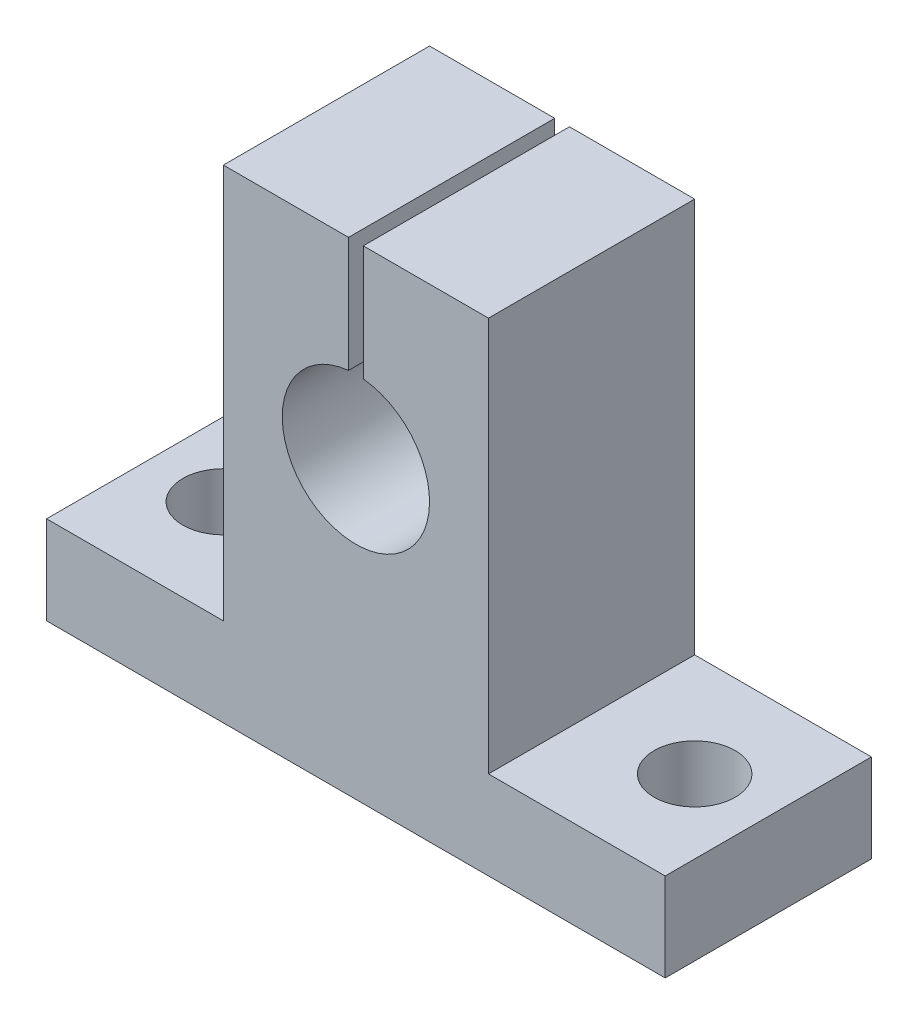
from build123d import *

# Parameters (mm, degrees)
EXTRUDE_3_DEPTH     = 14
SKETCH_5_R          = 2.75
CUT_EXTRUDE_1_DEPTH = 37.813584449


with BuildPart() as part:
    # 草图4 → 凸台-拉伸3 (new body)
    with BuildSketch(Plane.XY):
        with BuildLine():
            Line((-21, -14), (-21, -20))
            Line((-21, -20), (21, -20))
            Line((21, -20), (21, -14))
            Line((21, -14), (9, -14))
            Line((9, -14), (9, 12.8))
            Line((9, 12.8), (0.5, 12.8))
            Line((0.5, 12.8), (0.5, 4.974937186))
            ThreePointArc((0.5, 4.974937186), (3.708099244, 3.354101966), (5, 0))
            ThreePointArc((5, 0), (-3.354101966, -3.708099244), (-0.5, 4.974937186))
            Line((-0.5, 4.974937186), (-0.5, 12.8))
            Line((-0.5, 12.8), (-9, 12.8))
            Line((-9, 12.8), (-9, -14))
            Line((-9, -14), (-21, -14))
        make_face()
    extrude(amount=EXTRUDE_3_DEPTH)

    # 草图5 → 切除-拉伸1 (cut, through all)
    with BuildSketch(Plane(origin=(0, -14, 0), x_dir=(1, 0, 0), z_dir=(0, 1, 0))):
        with Locations(Location((-16, -7, 0), (0, 0, 270))):
            Circle(SKETCH_5_R)
        with Locations(Location((16, -7, 0), (0, 0, 270))):
            Circle(SKETCH_5_R)
    extrude(amount=-CUT_EXTRUDE_1_DEPTH, mode=Mode.SUBTRACT)


solid = part.part
